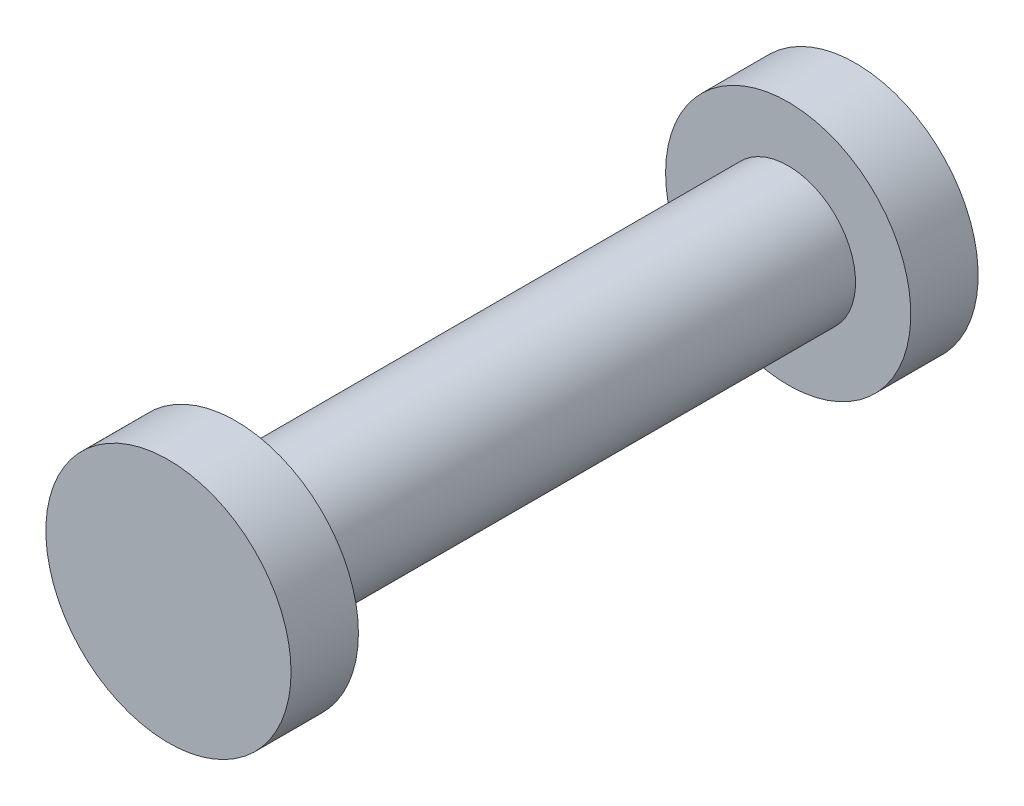
from build123d import *

# Parameters (mm, degrees)
SKETCH1_R           = 0.5
BOSS_EXTRUDE1_DEPTH = 5.1
SKETCH2_R           = 0.91
BOSS_EXTRUDE2_DEPTH = 0.5
BOSS_EXTRUDE3_START = -0.5
SKETCH3_R           = 0.91
BOSS_EXTRUDE3_DEPTH = 0.5


with BuildPart() as part:
    # Sketch1 → Boss-Extrude1 (new body)
    with BuildSketch(Plane.XY):
        Circle(SKETCH1_R)
    extrude(amount=BOSS_EXTRUDE1_DEPTH)

    # Sketch2 → Boss-Extrude2 (add)
    with BuildSketch(Plane.XY.offset(5.1)):
        Circle(SKETCH2_R)
    extrude(amount=-BOSS_EXTRUDE2_DEPTH)

    # Sketch3 → Boss-Extrude3 (add)
    with BuildSketch(Plane(origin=(0, 0, 0), x_dir=(-1, 0, 0), z_dir=(0, 0, -1)).offset(BOSS_EXTRUDE3_START)):
        with Locations(Location((0, 0, 0), (0, 0, 180))):
            Circle(SKETCH3_R)
    extrude(amount=BOSS_EXTRUDE3_DEPTH)


solid = part.part
